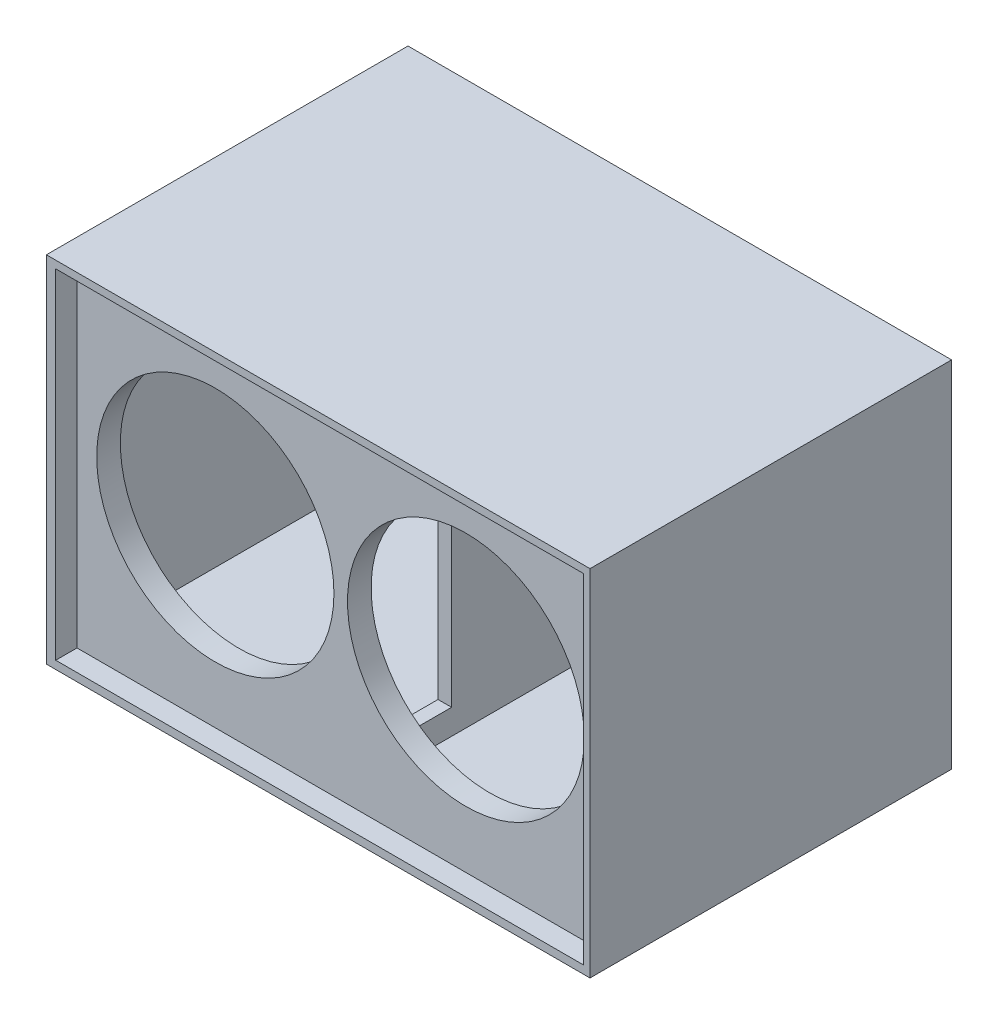
from build123d import *

# Parameters (mm, degrees)
SKETCH1_W           = 230
SKETCH1_H           = 150
BOSS_EXTRUDE1_DEPTH = 150
SKETCH2_R           = 50.188302383
SKETCH2_R_2         = 50.087955562
CUT_EXTRUDE1_DEPTH  = 27
SKETCH3_W           = 219.220450204
SKETCH3_H           = 138.871598106
CUT_EXTRUDE2_DEPTH  = 134
SKETCH4_W           = 230
SKETCH4_H           = 150
BOSS_EXTRUDE2_DEPTH = 3
SKETCH5_W           = 223.297854639
SKETCH5_H           = 143.428697179
CUT_EXTRUDE3_DEPTH  = 9
SKETCH7_W           = 5.736257362
SKETCH7_H           = 137.728394846
BOSS_EXTRUDE5_DEPTH = 110
SKETCH8_R           = 1.5
CUT_EXTRUDE4_DEPTH  = 10
SKETCH9_W           = 34.045014521
SKETCH9_H           = 115.879735823
CUT_EXTRUDE5_DEPTH  = 10


with BuildPart() as part:
    # Sketch1 → Boss-Extrude1 (new body)
    with BuildSketch(Plane.XY):
        with Locations((4.141274238, -2.686980609)):
            Rectangle(SKETCH1_W, SKETCH1_H)
    extrude(amount=BOSS_EXTRUDE1_DEPTH)

    # Sketch2 → Cut-Extrude1 (cut)
    with BuildSketch(Plane.XY.offset(150)):
        with Locations((-48.385288776, 0)):
            Circle(SKETCH2_R)
        with Locations((57.627226531, 0)):
            Circle(SKETCH2_R_2)
    extrude(amount=-CUT_EXTRUDE1_DEPTH, mode=Mode.SUBTRACT)

    # Sketch3 → Cut-Extrude2 (cut)
    with BuildSketch(Plane(origin=(0, 0, 0), x_dir=(-1, 0, 0), z_dir=(0, 0, -1))):
        with Locations((-4.141274238, -3.166675249)):
            Rectangle(SKETCH3_W, SKETCH3_H)
    extrude(amount=-CUT_EXTRUDE2_DEPTH, mode=Mode.SUBTRACT)

    # Sketch4 → Boss-Extrude2 (add)
    with BuildSketch(Plane.XY.offset(150)):
        with Locations((4.141274238, -2.686980609)):
            Rectangle(SKETCH4_W, SKETCH4_H)
    extrude(amount=BOSS_EXTRUDE2_DEPTH)

    # Sketch5 → Cut-Extrude3 (cut)
    with BuildSketch(Plane.XY.offset(153)):
        with Locations((4.740892538, -2.567056949)):
            Rectangle(SKETCH5_W, SKETCH5_H)
    extrude(amount=-CUT_EXTRUDE3_DEPTH, mode=Mode.SUBTRACT)

    # Sketch7 → Boss-Extrude5 (add)
    with BuildSketch(Plane(origin=(0, 0, 134), x_dir=(-1, 0, 0), z_dir=(0, 0, -1))):
        with Locations((-4.671142288, -2.595073619)):
            Rectangle(SKETCH7_W, SKETCH7_H)
    extrude(amount=BOSS_EXTRUDE5_DEPTH)

    # Sketch8 → Cut-Extrude4 (cut)
    with BuildSketch(Plane(origin=(0, 0, 0), x_dir=(-1, 0, 0), z_dir=(0, 0, -1))):
        with Locations((-116.215713327, 69.343694299)):
            Circle(SKETCH8_R)
        with Locations((108.173667939, -74.477152429)):
            Circle(SKETCH8_R)
    extrude(amount=-CUT_EXTRUDE4_DEPTH, mode=Mode.SUBTRACT)

    # Sketch9 → Cut-Extrude5 (cut)
    with BuildSketch(Plane(origin=(7.539270969, 0, 0), x_dir=(0, 0, -1), z_dir=(1, 0, 0))):
        with Locations((-116.97749274, -2.881933203)):
            Rectangle(SKETCH9_W, SKETCH9_H)
    extrude(amount=-CUT_EXTRUDE5_DEPTH, mode=Mode.SUBTRACT)


solid = part.part
